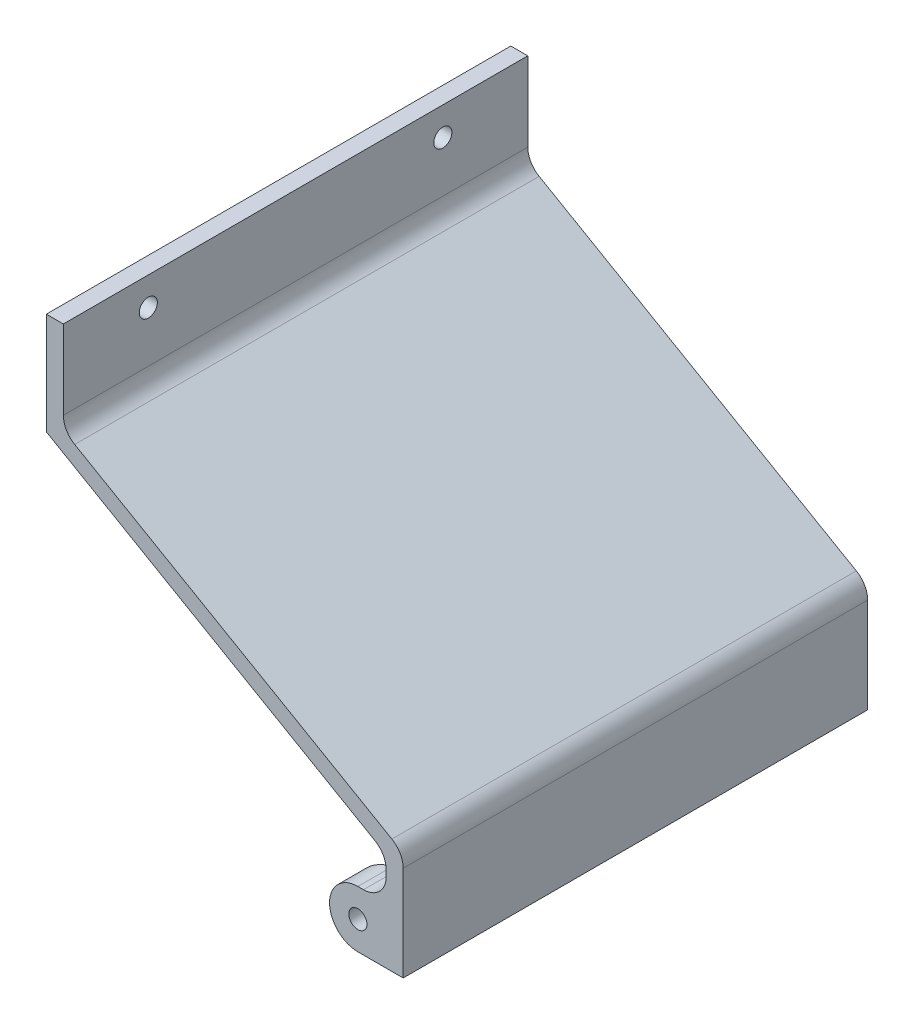
from build123d import *

# Parameters (mm, degrees)
EXTRUDE_1_DEPTH     = 82
CUT_EXTRUDE_1_REACH = 109.835
SKETCH_2_R          = 1.6
SKETCH_3_R          = 1.6
EXTRUDE_2_DEPTH     = 10
CUT_EXTRUDE_2_DEPTH = 10
SKETCH_5_R          = 3
CUT_EXTRUDE_3_DEPTH = 10
EXTRUDE_START       = -10
SKETCH_6_R          = 1.6
EXTRUDE_3_DEPTH     = 10
CUT_EXTRUDE_4_REACH = 114.322
CUT_EXTRUDE_START   = -10
SKETCH_8_R          = 3
CUT_EXTRUDE_5_DEPTH = 10
FILLET_1_R          = 4


with BuildPart() as part:
    # 草图1 → 凸台-拉伸1 (new body)
    with BuildSketch(Plane.XY):
        Polygon((-31.5, 18.115697408), (28.5, -16.525318744), (28.5, -33.884302592), (31.5, -33.884302592), (31.5, -14.793267936), (28.5, -13.061217128), (-28.5, 19.847748215), (-28.5, 36.115697408), (-31.5, 36.115697408), align=None)
    extrude(amount=EXTRUDE_1_DEPTH)

    # 草图2 → 切除-拉伸1 (cut, up to next)
    with BuildSketch(Plane(origin=(-28.5, 0, 0), x_dir=(0, 0, -1), z_dir=(1, 0, 0)), mode=Mode.PRIVATE) as cut_extrude_1_sk1:
        with Locations(Location((-67, 31.115697408, 0), (0, 0, 90))):
            Circle(SKETCH_2_R)
    cut_extrude_1_tool1 = extrude(cut_extrude_1_sk1.sketch, amount=-CUT_EXTRUDE_1_REACH, mode=Mode.PRIVATE) & part.part
    # 草图2 → 切除-拉伸1 (cut, up to next)
    with BuildSketch(Plane(origin=(-28.5, 0, 0), x_dir=(0, 0, -1), z_dir=(1, 0, 0)), mode=Mode.PRIVATE) as cut_extrude_1_sk2:
        with Locations(Location((-15, 31.115697408, 0), (0, 0, 90))):
            Circle(SKETCH_2_R)
    cut_extrude_1_tool2 = extrude(cut_extrude_1_sk2.sketch, amount=-CUT_EXTRUDE_1_REACH, mode=Mode.PRIVATE) & part.part
    add(cut_extrude_1_tool1.solids().sort_by_distance((-28.5, 31.115697, 67))[0], mode=Mode.SUBTRACT)
    add(cut_extrude_1_tool2.solids().sort_by_distance((-28.5, 31.115697, 15))[0], mode=Mode.SUBTRACT)

    # 草图3 → 凸台-拉伸2 (add)
    with BuildSketch(Plane(origin=(0, 0, 0), x_dir=(-1, 0, 0), z_dir=(0, 0, -1))):
        with BuildLine():
            Line((-28.5, -33.884302592), (-23.5, -33.884302592))
            ThreePointArc((-23.5, -33.884302592), (-18.5, -28.884302592), (-23.5, -23.884302592))
            Line((-23.5, -23.884302592), (-28.5, -23.884302592))
            Line((-28.5, -23.884302592), (-28.5, -33.884302592))
        make_face()
        with Locations((-23.5, -28.884302592)):
            Circle(SKETCH_3_R, mode=Mode.SUBTRACT)
    extrude(amount=-EXTRUDE_2_DEPTH)

    # 草图4 → 切除-拉伸2 (cut)
    with BuildSketch(Plane.XZ.offset(33.884302592)):
        with BuildLine():
            Line((15.48929146, 10), (15.48929146, 5))
            Line((15.48929146, 5), (18.5, 5))
            add(Edge.make_bspline(
                [(28.5, 10), (26.534032888, 6.656358998), (22.320432112, 5.379510278), (18.5, 5)],
                knots=[0, 0, 0, 0, 1, 1, 1, 1], degree=3))
            Line((28.5, 10), (15.48929146, 10))
        make_face()
    extrude(amount=-CUT_EXTRUDE_2_DEPTH, mode=Mode.SUBTRACT)

    # 草图5 → 切除-拉伸3 (cut)
    with BuildSketch(Plane(origin=(0, 0, 5), x_dir=(-1, 0, 0), z_dir=(0, 0, -1))):
        with Locations((-23.5, -28.884302592)):
            Circle(SKETCH_5_R)
    extrude(amount=-CUT_EXTRUDE_3_DEPTH, mode=Mode.SUBTRACT)

    # 草图6 → 凸台-拉伸3 (add)
    with BuildSketch(Plane.XY.offset(82).offset(EXTRUDE_START)):
        with BuildLine():
            Line((28.5, -23.884302592), (23.5, -23.884302592))
            ThreePointArc((23.5, -23.884302592), (18.5, -28.884302592), (23.5, -33.884302592))
            Line((23.5, -33.884302592), (28.5, -33.884302592))
            Line((28.5, -33.884302592), (28.5, -23.884302592))
        make_face()
        with Locations(Location((23.5, -28.884302592, 0), (0, 0, 180))):
            Circle(SKETCH_6_R, mode=Mode.SUBTRACT)
    extrude(amount=EXTRUDE_3_DEPTH)

    # 草图7 → 切除-拉伸4 (cut, up to next)
    with BuildSketch(Plane.XZ.offset(33.884302592), mode=Mode.PRIVATE) as cut_extrude_4_sk1:
        with BuildLine():
            Line((28.5, 72), (15.711275948, 72))
            Line((15.711275948, 72), (15.711275948, 77))
            Line((15.711275948, 77), (18.5, 77))
            add(Edge.make_bspline(
                [(28.5, 72), (25.18574882, 75.388408821), (22.578679104, 76.660150146), (18.5, 77)],
                knots=[0, 0, 0, 0, 1, 1, 1, 1], degree=3))
        make_face()
    cut_extrude_4_tool1 = extrude(cut_extrude_4_sk1.sketch, amount=-CUT_EXTRUDE_4_REACH, mode=Mode.PRIVATE) & part.part
    add(cut_extrude_4_tool1.solids().sort_by_distance((20.757737, -33.884303, 74.139279))[0], mode=Mode.SUBTRACT)

    # 草图8 → 切除-拉伸5 (cut)
    with BuildSketch(Plane.XY.offset(77).offset(CUT_EXTRUDE_START)):
        with Locations(Location((23.5, -28.884302592, 0), (0, 0, 180))):
            Circle(SKETCH_8_R)
    extrude(amount=CUT_EXTRUDE_5_DEPTH, mode=Mode.SUBTRACT)

    # 圆角1
    fillet_1_edges = [part.edges().sort_by_distance(p)[0] for p in [
        (28.5, -16.525318744, 41),
        (31.5, -14.793267936, 41),
        (-28.5, 19.847748215, 41),
        (28.5, -23.884302592, 77),
        (28.5, -23.884302592, 5),
    ]]
    fillet(fillet_1_edges, radius=FILLET_1_R)


solid = part.part
